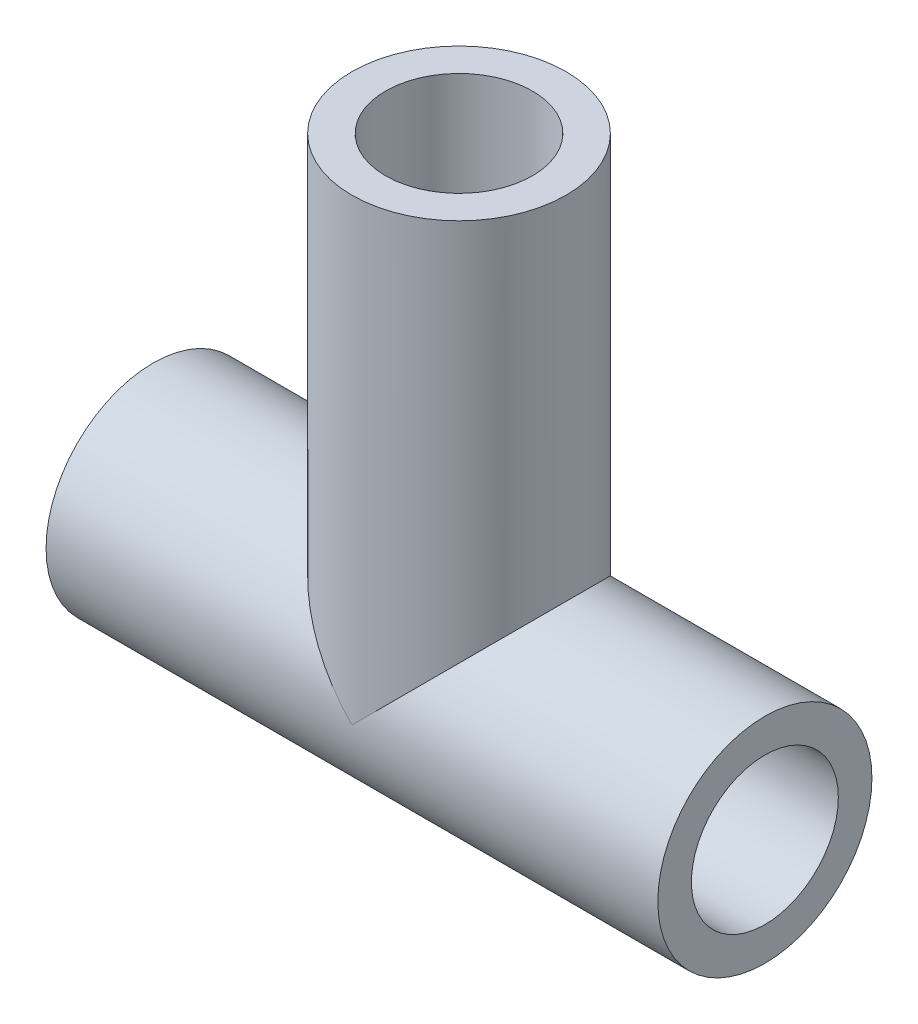
from build123d import *

# Parameters (mm, degrees)
SKETCH1_R               = 4.445
BOSS_EXTRUDE1_DEPTH     = 25.4
SKETCH2_R               = 4.445
BOSS_EXTRUDE2_DEPTH     = 19.05
SKETCH3_R               = 3.05
CUT_EXTRUDE1_DEPTH      = 33.059640126
CUT_EXTRUDE2_REACH      = 36.885
CUT_EXTRUDE2_END_RADIUS = 3.05
SKETCH4_R               = 3.05


with BuildPart() as part:
    # Sketch1 → Boss-Extrude1 (new body)
    with BuildSketch(Plane(origin=(0, 0, 0), x_dir=(0, 0, -1), z_dir=(1, 0, 0))):
        Circle(SKETCH1_R)
    extrude(amount=BOSS_EXTRUDE1_DEPTH)

    # Sketch2 → Boss-Extrude2 (add)
    with BuildSketch(Plane(origin=(0, 0, 0), x_dir=(1, 0, 0), z_dir=(0, 1, 0))):
        with Locations(Location((12.7, 0, 0), (0, 0, 270))):
            Circle(SKETCH2_R)
    extrude(amount=BOSS_EXTRUDE2_DEPTH)

    # Sketch3 → Cut-Extrude1 (cut, through all)
    with BuildSketch(Plane(origin=(25.4, 0, 0), x_dir=(0, 0, -1), z_dir=(1, 0, 0))):
        Circle(SKETCH3_R)
    extrude(amount=-CUT_EXTRUDE1_DEPTH, mode=Mode.SUBTRACT)

    # Cut-Extrude2: up to this cylinder (the profile starts outside it)
    cut_extrude2_end = Plane(origin=(12.7, 0, 0), z_dir=(1, 0, 0)) * Cylinder(CUT_EXTRUDE2_END_RADIUS, 80.87, mode=Mode.PRIVATE)
    # Sketch4 → Cut-Extrude2 (cut, up to the surface)
    with BuildSketch(Plane(origin=(0, 19.05, 0), x_dir=(1, 0, 0), z_dir=(0, 1, 0)), mode=Mode.PRIVATE) as cut_extrude2_sk1:
        with Locations(Location((12.7, 0, 0), (0, 0, 270))):
            Circle(SKETCH4_R)
    cut_extrude2_tool1 = extrude(cut_extrude2_sk1.sketch, amount=-CUT_EXTRUDE2_REACH, mode=Mode.PRIVATE) - cut_extrude2_end
    add(cut_extrude2_tool1.solids().sort_by_distance((12.7, 19.05, 0))[0], mode=Mode.SUBTRACT)


solid = part.part
